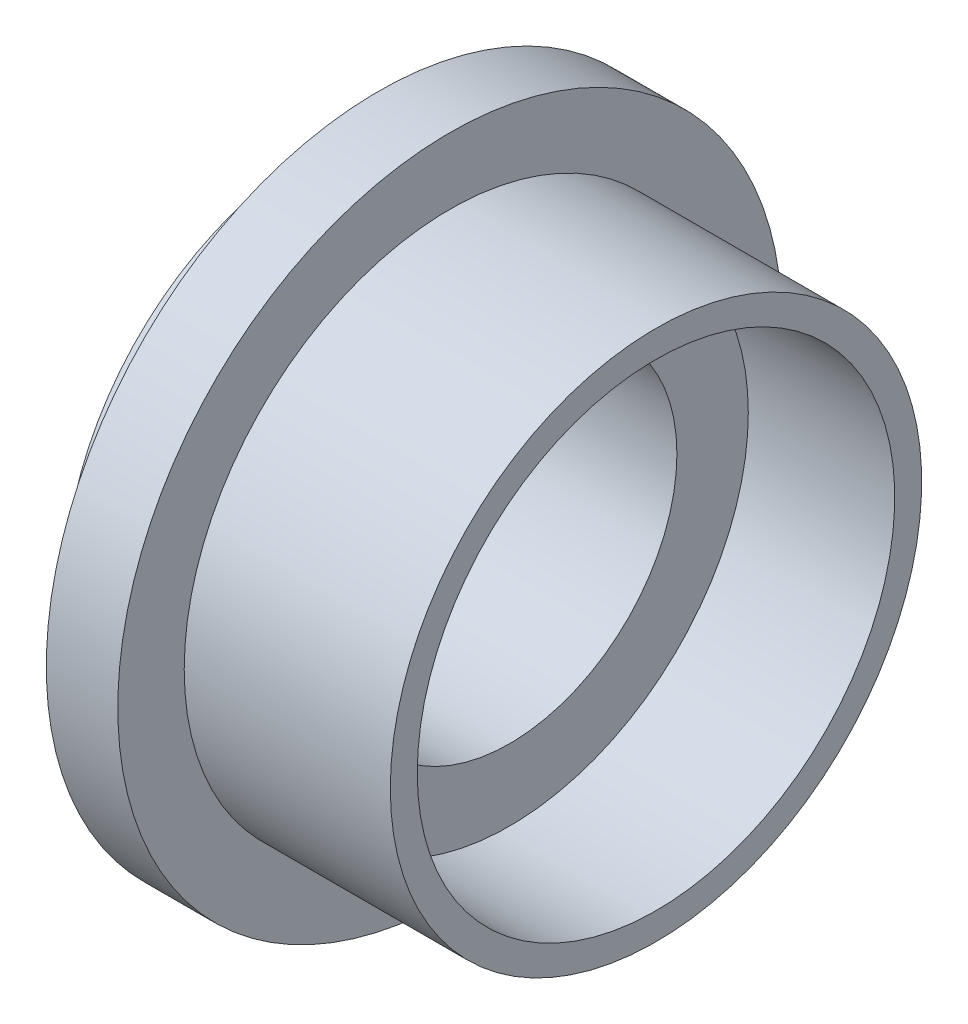
from build123d import *

# Parameters (mm, degrees)
SKETCH2_R           = 12.7
SKETCH2_R_2         = 11.412
BOSS_EXTRUDE1_DEPTH = 9.85


with BuildPart() as part:
    # Sketch1 → Revolve1 (revolve)
    with BuildSketch(Plane.XY, mode=Mode.PRIVATE) as revolve1_sk:
        with BuildLine():
            Line((-3.5, 8), (-3.5, 11.412))
            Line((-3.5, 11.412), (-6.35, 11.412))
            Line((-6.35, 11.412), (-6.35, 15.875))
            Line((-6.35, 15.875), (-9.767060633, 15.875))
            Line((-9.767060633, 15.875), (-11.600147737, 12.7))
            ThreePointArc((-11.600147737, 12.7), (-12.065, 12.235147737), (-12.7, 12.065))
            Line((-12.7, 12.065), (-12.7, 8))
            Line((-12.7, 8), (-3.5, 8))
        make_face()
    revolve(revolve1_sk.sketch.rotate(Axis((0, 0, 0), (-1, 0, 0)), 90), axis=Axis((0, 0, 0), (-1, 0, 0)))

    # Sketch2 → Boss-Extrude1 (add)
    with BuildSketch(Plane(origin=(-6.35, 0, 0), x_dir=(0, 0, -1), z_dir=(1, 0, 0))):
        with Locations(Location((0, 0, 0), (0, 0, 180))):
            Circle(SKETCH2_R)
        with Locations(Location((0, 0, 0), (0, 0, 180))):
            Circle(SKETCH2_R_2, mode=Mode.SUBTRACT)
    extrude(amount=BOSS_EXTRUDE1_DEPTH)


solid = part.part
